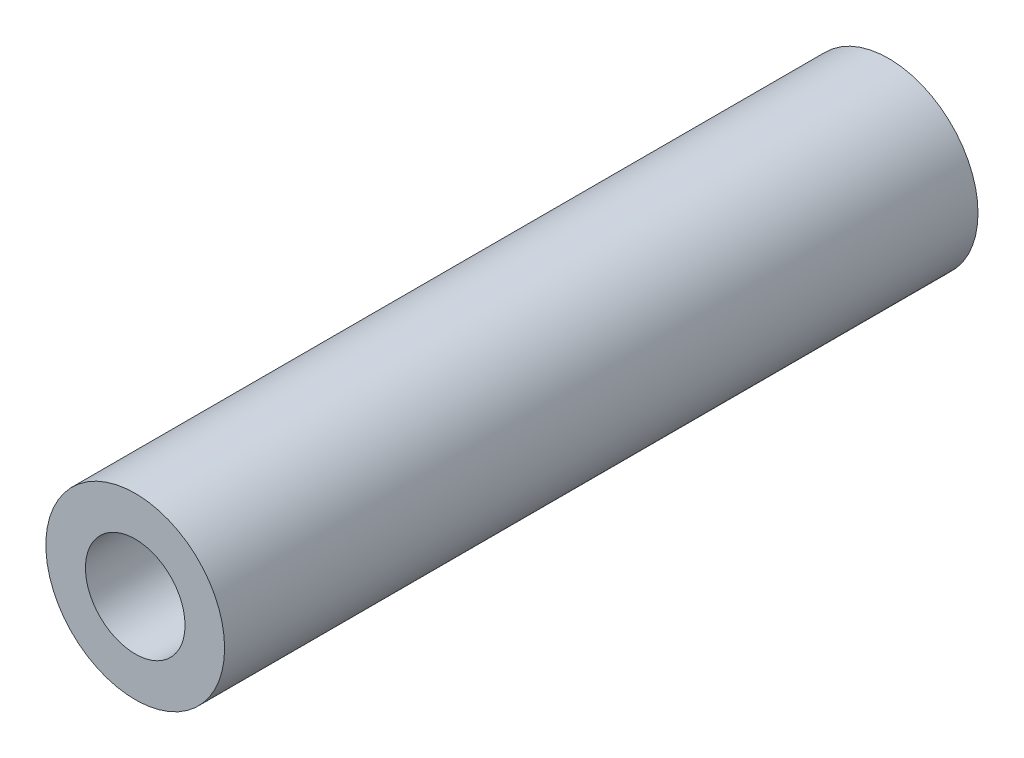
from build123d import *

# Parameters (mm, degrees)
ESQUISSE1_R                               = 3.5
BOSS_EXTRU_1_DEPTH                        = 29.5
TROU_POUR_TARAUDAGE_POUR_TROU_TARAUD_M4_D = 3.9


with BuildPart() as part:
    # Esquisse1 → Boss.-Extru.1 (new body)
    with BuildSketch(Plane.XY):
        Circle(ESQUISSE1_R)
    extrude(amount=BOSS_EXTRU_1_DEPTH)

    # Trou pour taraudage pour trou taraudé M41 (through all)
    with Locations(Plane.XY.offset(29.5)):
        with Locations((0, 0)):
            Hole(TROU_POUR_TARAUDAGE_POUR_TROU_TARAUD_M4_D / 2)


solid = part.part
